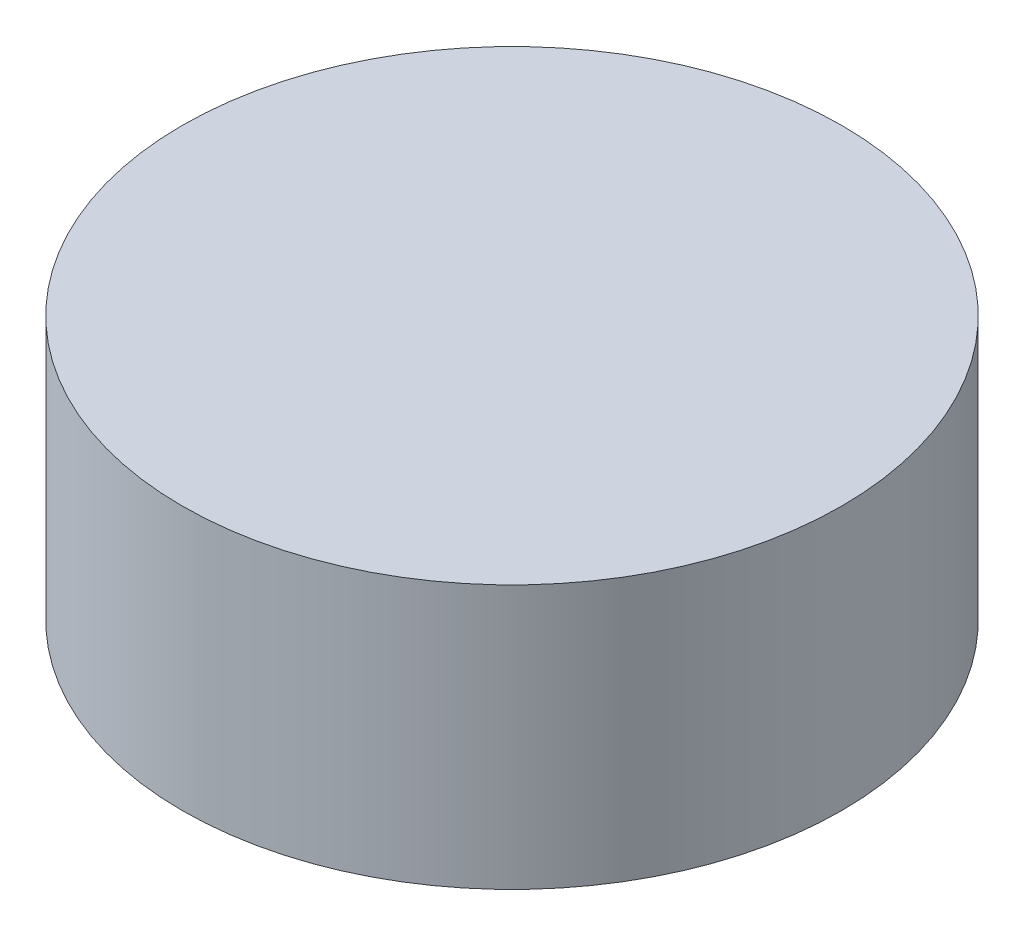
from build123d import *

# Parameters (mm, degrees)
SKETCH_1_R      = 40
EXTRUDE_1_DEPTH = 32


with BuildPart() as part:
    # 草图1 → 凸台-拉伸1 (new body)
    with BuildSketch(Plane(origin=(0, 0, 0), x_dir=(1, 0, 0), z_dir=(0, 1, 0))):
        with Locations(Location((0, 0, 0), (0, 0, 270))):
            Circle(SKETCH_1_R)
    extrude(amount=EXTRUDE_1_DEPTH)


solid = part.part
